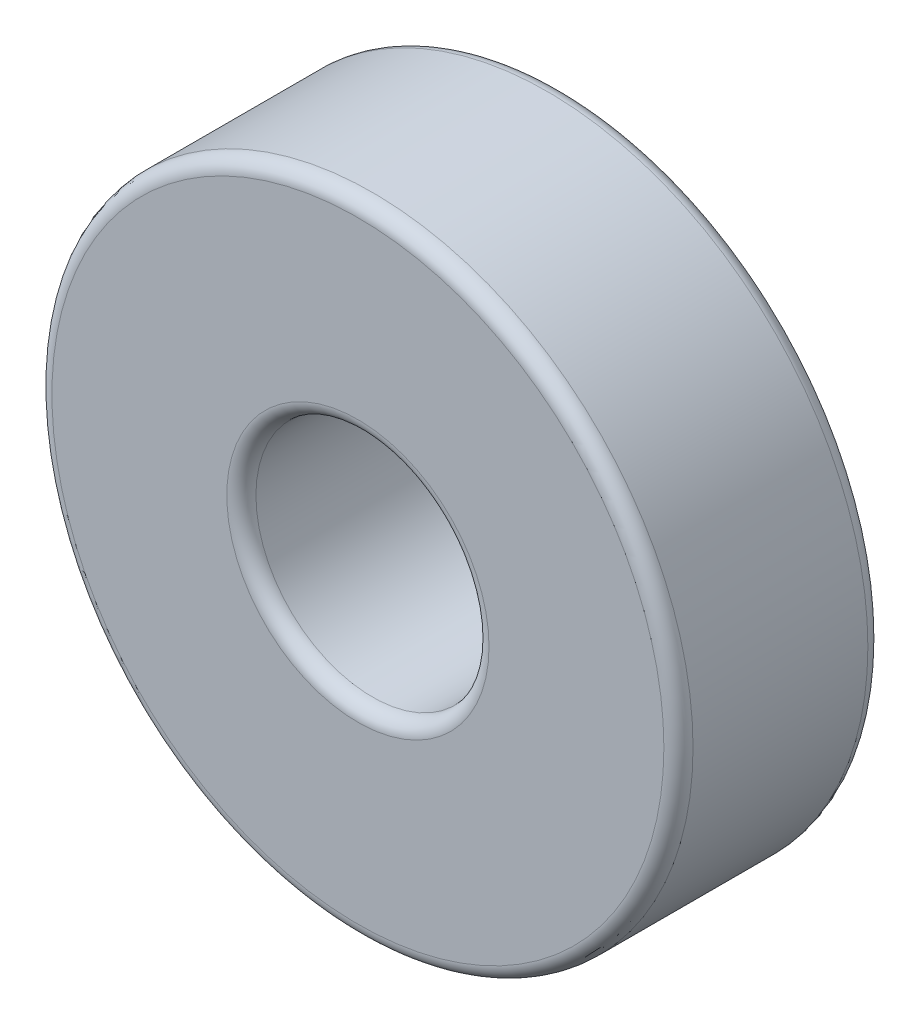
from build123d import *

# Parameters (mm, degrees)
SKETCH1_R           = 11
SKETCH1_R_2         = 4
BOSS_EXTRUDE1_DEPTH = 7
FILLET1_R           = 0.5


with BuildPart() as part:
    # Sketch1 → Boss-Extrude1 (new body)
    with BuildSketch(Plane.XY):
        Circle(SKETCH1_R)
        Circle(SKETCH1_R_2, mode=Mode.SUBTRACT)
    extrude(amount=BOSS_EXTRUDE1_DEPTH)

    # Fillet1
    fillet1_edges = [part.edges().sort_by_distance(p)[0] for p in [
        (-11, 0, 0),
        (-11, 0, 7),
        (-4, 0, 0),
        (-4, 0, 7),
    ]]
    fillet(fillet1_edges, radius=FILLET1_R)


solid = part.part
